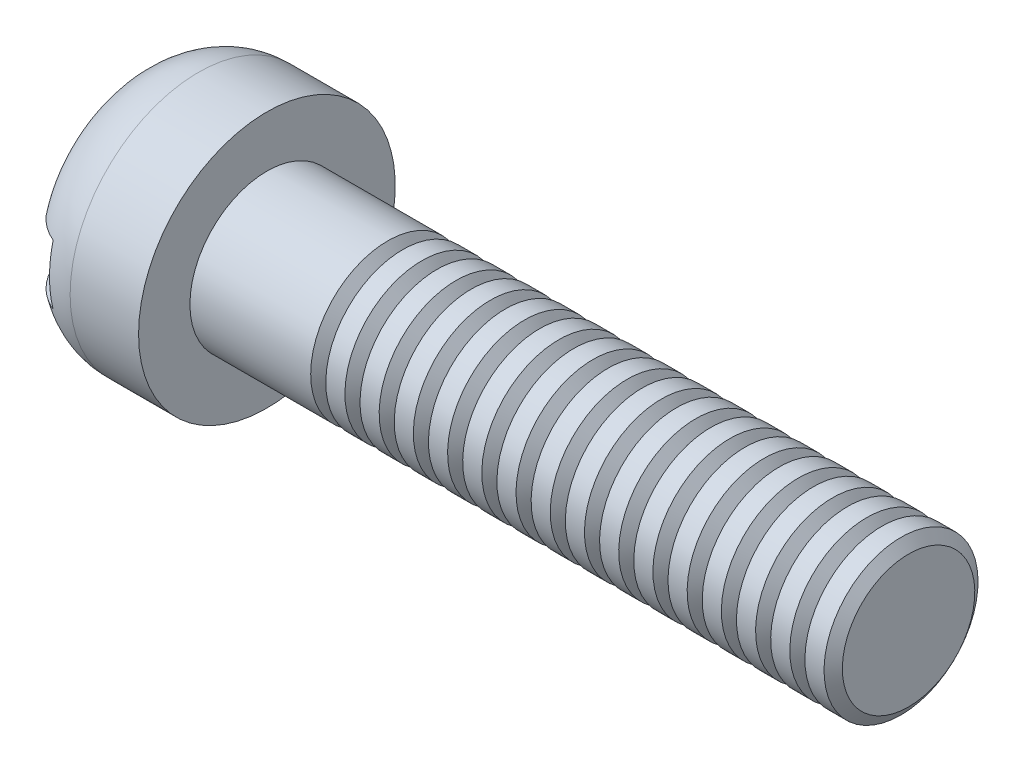
from build123d import *

# Parameters (mm, degrees)
SKETCH2_W       = 3
SKETCH2_H       = 0.7
SLOT_DEPTH      = 0.5
THDSCHPAT_COUNT = 16
THDSCHPAT_PITCH = 0.4


with BuildPart() as part:
    # BodySke → Base-Revolve (revolve)
    with BuildSketch(Plane.XY, mode=Mode.PRIVATE) as base_revolve_sk:
        with BuildLine():
            Line((1.6, 0.9), (1.6, 1.5))
            Line((1.6, 1.5), (0.8, 1.5))
            ThreePointArc((0.8, 1.5), (0.234314575, 1.265685425), (0, 0.7))
            Line((0, 0.7), (0, 0))
            Line((0, 0), (9.1, 0))
            Line((9.1, 0), (9.1, 0.9))
            Line((9.1, 0.9), (1.6, 0.9))
        make_face()
    revolve(base_revolve_sk.sketch.rotate(Axis((-25.4, 0, 0), (1, 0, 0)), 90), axis=Axis((-25.4, 0, 0), (1, 0, 0)))

    # Sketch2 → Slot (cut)
    with BuildSketch(Plane(origin=(0, 0, 0), x_dir=(0, 0, -1), z_dir=(1, 0, 0))):
        Rectangle(SKETCH2_W, SKETCH2_H)
    extrude(amount=SLOT_DEPTH, mode=Mode.SUBTRACT)

    # ThdSchSke → ThreadSchematic (revolve, cut)
    with BuildSketch(Plane.XY, mode=Mode.PRIVATE) as threadschematic_sk:
        Polygon((3.1, -0.774), (3.01177385, -0.9), (3.01177385, -1.35), (3.18822615, -1.35), (3.18822615, -0.9), align=None)
    threadschematic = revolve(threadschematic_sk.sketch.rotate(Axis((-3.175, 0, 0), (1, 0, 0)), 270), axis=Axis((-3.175, 0, 0), (1, 0, 0)), mode=Mode.SUBTRACT)

    # ThdSchPat: ThreadSchematic ×16
    with Locations(*[(i * THDSCHPAT_PITCH, 0, 0) for i in range(1, THDSCHPAT_COUNT)]):
        add(threadschematic, mode=Mode.SUBTRACT)


solid = part.part
